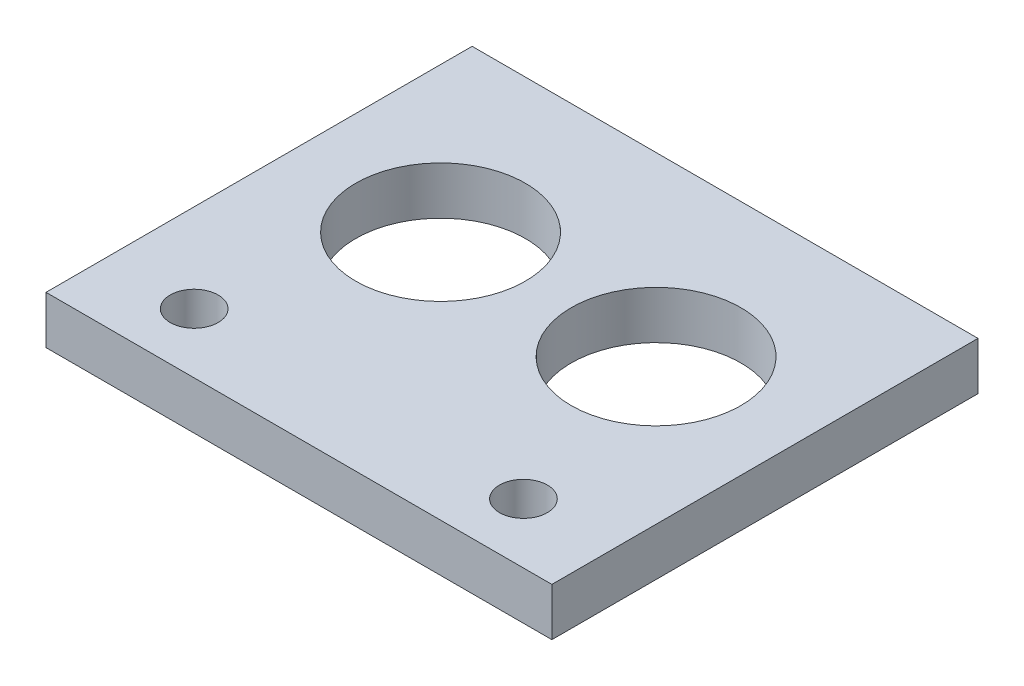
from build123d import *

# Parameters (mm, degrees)
SKETCH1_W           = 26.83
SKETCH1_H           = 22.6
SKETCH1_R           = 4.5
SKETCH1_R_2         = 1.27
BOSS_EXTRUDE1_DEPTH = 2.54


with BuildPart() as part:
    # Sketch1 → Boss-Extrude1 (new body)
    with BuildSketch(Plane(origin=(0, 0, 0), x_dir=(1, 0, 0), z_dir=(0, 1, 0))):
        with Locations((10.915, 4.95)):
            Rectangle(SKETCH1_W, SKETCH1_H)
        with Locations(Location((5.2, 6.875, 0), (0, 0, 270))):
            Circle(SKETCH1_R, mode=Mode.SUBTRACT)
        with Locations(Location((16.63, 6.875, 0), (0, 0, 270))):
            Circle(SKETCH1_R, mode=Mode.SUBTRACT)
        with Locations(Location((2.18375, -3.175, 0), (0, 0, 270))):
            Circle(SKETCH1_R_2, mode=Mode.SUBTRACT)
        with Locations(Location((19.64625, -3.175, 0), (0, 0, 270))):
            Circle(SKETCH1_R_2, mode=Mode.SUBTRACT)
    extrude(amount=BOSS_EXTRUDE1_DEPTH)


solid = part.part
